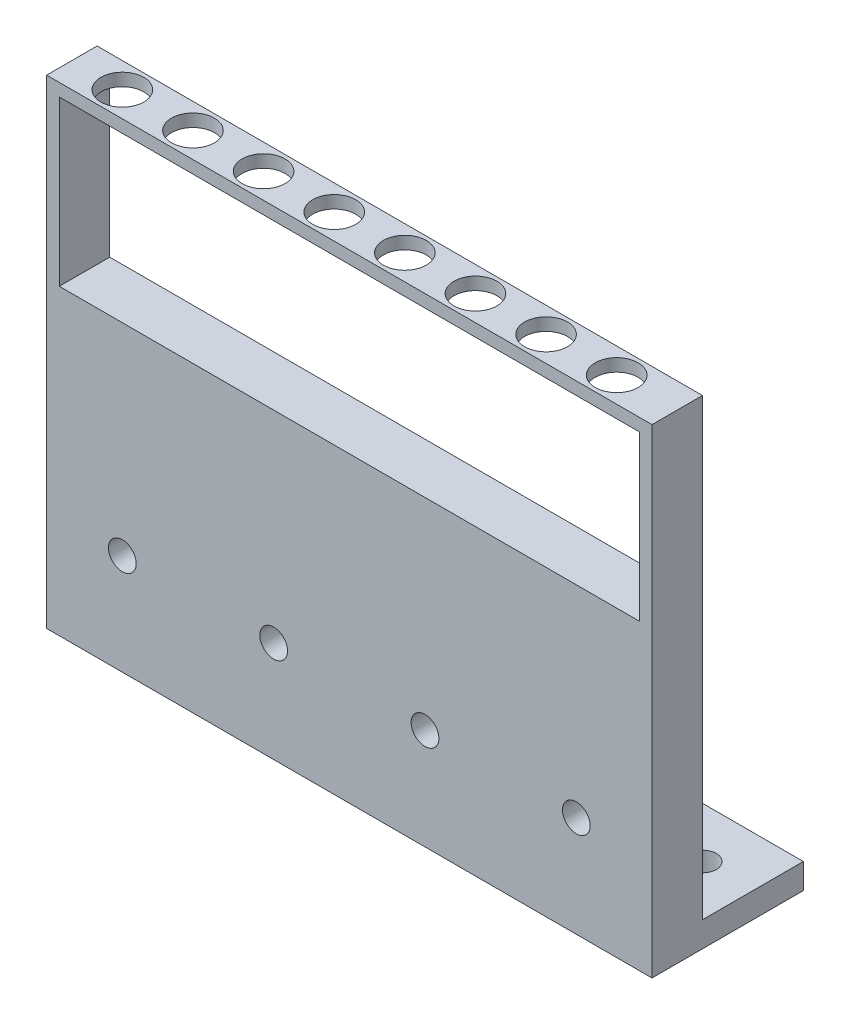
from build123d import *

# Parameters (mm, degrees)
SKETCH1_W           = 152.4
SKETCH1_H           = 12.7
BOSS_EXTRUDE1_DEPTH = 76.2
SKETCH2_R           = 3.4925
BOSS_EXTRUDE4_DEPTH = 6.35
BOSS_EXTRUDE5_DEPTH = 12.7
CUT_EXTRUDE1_REACH  = 148.188
SKETCH4_R           = 5.3975
SKETCH5_R           = 3.4925
CUT_EXTRUDE2_DEPTH  = 145.941445074


with BuildPart() as part:
    # Sketch1 → Boss-Extrude1 (new body)
    with BuildSketch(Plane(origin=(0, 0, 0), x_dir=(1, 0, 0), z_dir=(0, 1, 0))):
        Rectangle(SKETCH1_W, SKETCH1_H)
    extrude(amount=BOSS_EXTRUDE1_DEPTH)

    # Sketch2 → Boss-Extrude4 (add)
    with BuildSketch(Plane(origin=(0, 0, 0), x_dir=(1, 0, 0), z_dir=(0, 1, 0))):
        Polygon((-76.2, 19.05), (-76.2, 6.35), (76.2, 6.35), (76.2, 31.75), (-76.2, 31.75), align=None)
        with Locations(Location((-63.5, 19.05, 0), (0, 0, 270))):
            Circle(SKETCH2_R, mode=Mode.SUBTRACT)
        with Locations(Location((-38.1, 19.05, 0), (0, 0, 270))):
            Circle(SKETCH2_R, mode=Mode.SUBTRACT)
        with Locations(Location((-12.7, 19.05, 0), (0, 0, 270))):
            Circle(SKETCH2_R, mode=Mode.SUBTRACT)
        with Locations(Location((12.7, 19.05, 0), (0, 0, 270))):
            Circle(SKETCH2_R, mode=Mode.SUBTRACT)
        with Locations(Location((38.1, 19.05, 0), (0, 0, 270))):
            Circle(SKETCH2_R, mode=Mode.SUBTRACT)
        with Locations(Location((63.5, 19.05, 0), (0, 0, 270))):
            Circle(SKETCH2_R, mode=Mode.SUBTRACT)
    extrude(amount=BOSS_EXTRUDE4_DEPTH)

    # Sketch3 → Boss-Extrude5 (add)
    with BuildSketch(Plane.XY.offset(6.35)):
        Polygon((-76.2, 76.2), (-76.2, 120.65), (76.2, 120.65), (76.2, 76.2), (73.025, 76.2), (73.025, 117.475), (-73.025, 117.475), (-73.025, 76.2), align=None)
    extrude(amount=-BOSS_EXTRUDE5_DEPTH)

    # Sketch4 → Cut-Extrude1 (cut, up to next)
    with BuildSketch(Plane(origin=(0, 120.65, 0), x_dir=(1, 0, 0), z_dir=(0, 1, 0)), mode=Mode.PRIVATE) as cut_extrude1_sk1:
        with Locations(Location((-63.5, 0, 0), (0, 0, 270))):
            Circle(SKETCH4_R)
    cut_extrude1_tool1 = extrude(cut_extrude1_sk1.sketch, amount=-CUT_EXTRUDE1_REACH, mode=Mode.PRIVATE) & part.part
    # Sketch4 → Cut-Extrude1 (cut, up to next)
    with BuildSketch(Plane(origin=(0, 120.65, 0), x_dir=(1, 0, 0), z_dir=(0, 1, 0)), mode=Mode.PRIVATE) as cut_extrude1_sk2:
        with Locations(Location((-45.72, 0, 0), (0, 0, 270))):
            Circle(SKETCH4_R)
    cut_extrude1_tool2 = extrude(cut_extrude1_sk2.sketch, amount=-CUT_EXTRUDE1_REACH, mode=Mode.PRIVATE) & part.part
    # Sketch4 → Cut-Extrude1 (cut, up to next)
    with BuildSketch(Plane(origin=(0, 120.65, 0), x_dir=(1, 0, 0), z_dir=(0, 1, 0)), mode=Mode.PRIVATE) as cut_extrude1_sk3:
        with Locations(Location((-27.94, 0, 0), (0, 0, 270))):
            Circle(SKETCH4_R)
    cut_extrude1_tool3 = extrude(cut_extrude1_sk3.sketch, amount=-CUT_EXTRUDE1_REACH, mode=Mode.PRIVATE) & part.part
    # Sketch4 → Cut-Extrude1 (cut, up to next)
    with BuildSketch(Plane(origin=(0, 120.65, 0), x_dir=(1, 0, 0), z_dir=(0, 1, 0)), mode=Mode.PRIVATE) as cut_extrude1_sk4:
        with Locations(Location((-10.16, 0, 0), (0, 0, 270))):
            Circle(SKETCH4_R)
    cut_extrude1_tool4 = extrude(cut_extrude1_sk4.sketch, amount=-CUT_EXTRUDE1_REACH, mode=Mode.PRIVATE) & part.part
    # Sketch4 → Cut-Extrude1 (cut, up to next)
    with BuildSketch(Plane(origin=(0, 120.65, 0), x_dir=(1, 0, 0), z_dir=(0, 1, 0)), mode=Mode.PRIVATE) as cut_extrude1_sk5:
        with Locations(Location((7.62, 0, 0), (0, 0, 270))):
            Circle(SKETCH4_R)
    cut_extrude1_tool5 = extrude(cut_extrude1_sk5.sketch, amount=-CUT_EXTRUDE1_REACH, mode=Mode.PRIVATE) & part.part
    # Sketch4 → Cut-Extrude1 (cut, up to next)
    with BuildSketch(Plane(origin=(0, 120.65, 0), x_dir=(1, 0, 0), z_dir=(0, 1, 0)), mode=Mode.PRIVATE) as cut_extrude1_sk6:
        with Locations(Location((25.4, 0, 0), (0, 0, 270))):
            Circle(SKETCH4_R)
    cut_extrude1_tool6 = extrude(cut_extrude1_sk6.sketch, amount=-CUT_EXTRUDE1_REACH, mode=Mode.PRIVATE) & part.part
    # Sketch4 → Cut-Extrude1 (cut, up to next)
    with BuildSketch(Plane(origin=(0, 120.65, 0), x_dir=(1, 0, 0), z_dir=(0, 1, 0)), mode=Mode.PRIVATE) as cut_extrude1_sk7:
        with Locations(Location((43.18, 0, 0), (0, 0, 270))):
            Circle(SKETCH4_R)
    cut_extrude1_tool7 = extrude(cut_extrude1_sk7.sketch, amount=-CUT_EXTRUDE1_REACH, mode=Mode.PRIVATE) & part.part
    # Sketch4 → Cut-Extrude1 (cut, up to next)
    with BuildSketch(Plane(origin=(0, 120.65, 0), x_dir=(1, 0, 0), z_dir=(0, 1, 0)), mode=Mode.PRIVATE) as cut_extrude1_sk8:
        with Locations(Location((60.96, 0, 0), (0, 0, 270))):
            Circle(SKETCH4_R)
    cut_extrude1_tool8 = extrude(cut_extrude1_sk8.sketch, amount=-CUT_EXTRUDE1_REACH, mode=Mode.PRIVATE) & part.part
    add(cut_extrude1_tool1.solids().sort_by_distance((-63.5, 120.65, 0))[0], mode=Mode.SUBTRACT)
    add(cut_extrude1_tool2.solids().sort_by_distance((-45.72, 120.65, 0))[0], mode=Mode.SUBTRACT)
    add(cut_extrude1_tool3.solids().sort_by_distance((-27.94, 120.65, 0))[0], mode=Mode.SUBTRACT)
    add(cut_extrude1_tool4.solids().sort_by_distance((-10.16, 120.65, 0))[0], mode=Mode.SUBTRACT)
    add(cut_extrude1_tool5.solids().sort_by_distance((7.62, 120.65, 0))[0], mode=Mode.SUBTRACT)
    add(cut_extrude1_tool6.solids().sort_by_distance((25.4, 120.65, 0))[0], mode=Mode.SUBTRACT)
    add(cut_extrude1_tool7.solids().sort_by_distance((43.18, 120.65, 0))[0], mode=Mode.SUBTRACT)
    add(cut_extrude1_tool8.solids().sort_by_distance((60.96, 120.65, 0))[0], mode=Mode.SUBTRACT)

    # Sketch5 → Cut-Extrude2 (cut, through all)
    with BuildSketch(Plane(origin=(0, 0, -6.35), x_dir=(-1, 0, 0), z_dir=(0, 0, -1))):
        with Locations((-57.15, 25.4)):
            Circle(SKETCH5_R)
        with Locations((-19.05, 25.4)):
            Circle(SKETCH5_R)
        with Locations((19.05, 25.4)):
            Circle(SKETCH5_R)
        with Locations((57.15, 25.4)):
            Circle(SKETCH5_R)
    extrude(amount=-CUT_EXTRUDE2_DEPTH, mode=Mode.SUBTRACT)


solid = part.part
